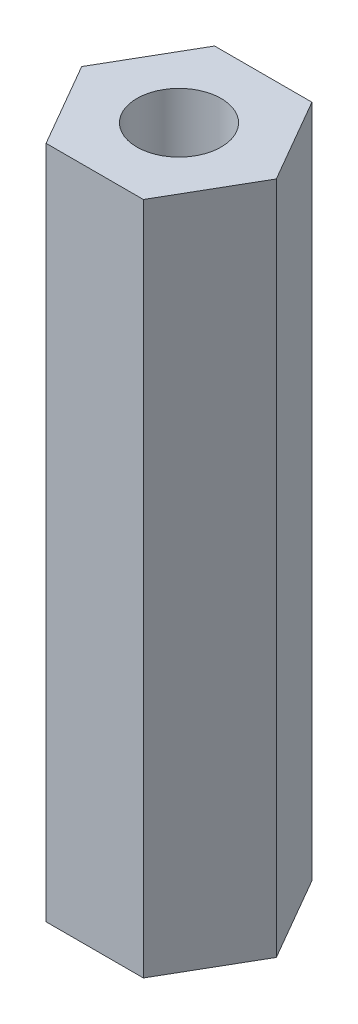
from build123d import *

# Parameters (mm, degrees)
SKETCH_1_R      = 1.25
EXTRUDE_1_DEPTH = 20


with BuildPart() as part:
    # 草图1 → 凸台-拉伸1 (new body)
    with BuildSketch(Plane.XZ):
        Polygon((-1.443375673, -2.5), (1.443375673, -2.5), (2.886751346, 0), (1.443375673, 2.5), (-1.443375673, 2.5), (-2.886751346, 0), align=None)
        with Locations(Location((0, 0, 0), (0, 0, 90))):
            Circle(SKETCH_1_R, mode=Mode.SUBTRACT)
    extrude(amount=-EXTRUDE_1_DEPTH)


solid = part.part
